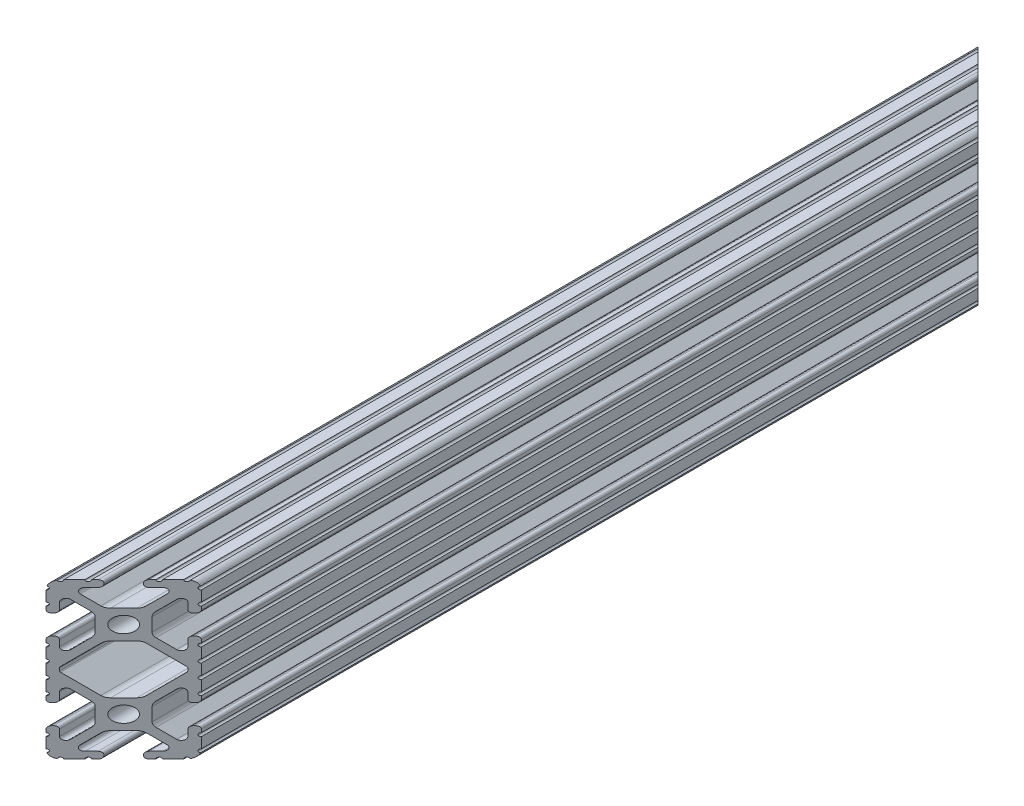
from build123d import *

# Parameters (mm, degrees)
BOSS_EXTRUDE1_DEPTH     = 152.4
CUT_EXTRUDE1_DEPTH      = 156.02325632
CUT_EXTRUDE1_DEPTH_BACK = 156.02325632
SKETCH5_R               = 0.55245
BOSS_EXTRUDE2_DEPTH     = 152.4
CUT_EXTRUDE2_DEPTH      = 156.02325632
CUT_EXTRUDE2_DEPTH_BACK = 156.02325632
CUT_EXTRUDE4_DEPTH      = 162.144934764


with BuildPart() as part:
    # Sketch4 → Boss-Extrude1 (new, symmetric)
    with BuildSketch(Plane.XY):
        with BuildLine():
            Line((4.190365, -25.4), (10.11729625, -25.4))
            ThreePointArc((10.11729625, -25.4), (11.943543585, -24.643543585), (12.7, -22.81729625))
            Line((12.7, -22.81729625), (12.7, -16.890365))
            ThreePointArc((12.7, -16.890365), (12.42492494, -16.22627506), (11.760835, -15.9512))
            Line((11.760835, -15.9512), (11.429365, -15.9512))
            ThreePointArc((11.429365, -15.9512), (10.76527506, -16.22627506), (10.4902, -16.890365))
            Line((10.4902, -16.890365), (10.4902, -19.048478019))
            ThreePointArc((10.4902, -19.048478019), (9.830707141, -20.035478831), (8.666460301, -19.803895736))
            Line((8.666460301, -19.803895736), (5.299899128, -16.437334563))
            ThreePointArc((5.299899128, -16.437334563), (4.817571085, -15.715479634), (4.6482, -14.86399369))
            Line((4.6482, -14.86399369), (4.6482, -12.7))
            Line((4.6482, -12.7), (2.6035, -12.7))
            ThreePointArc((2.6035, -12.7), (1.840952505, -14.540952505), (0, -15.3035))
            Line((0, -15.3035), (0, -17.3482))
            Line((0, -17.3482), (2.16399369, -17.3482))
            ThreePointArc((2.16399369, -17.3482), (3.015479634, -17.517571085), (3.737334563, -17.999899128))
            Line((3.737334563, -17.999899128), (7.103895736, -21.366460301))
            ThreePointArc((7.103895736, -21.366460301), (7.335478831, -22.530707141), (6.348478019, -23.1902))
            Line((6.348478019, -23.1902), (4.190365, -23.1902))
            ThreePointArc((4.190365, -23.1902), (3.52627506, -23.46527506), (3.2512, -24.129365))
            Line((3.2512, -24.129365), (3.2512, -24.460835))
            ThreePointArc((3.2512, -24.460835), (3.52627506, -25.12492494), (4.190365, -25.4))
        make_face()
    extrude(amount=BOSS_EXTRUDE1_DEPTH, both=True)

    # Sketch5 → Cut-Extrude1 (cut, two sides: drawn at the far end of the back side and taken through both)
    with BuildSketch(Plane.XY.offset(-CUT_EXTRUDE1_DEPTH_BACK)):
        with Locations((10.356153152, -25.4)):
            Circle(SKETCH5_R)
        with Locations((5.796028019, -25.4)):
            Circle(SKETCH5_R)
        with Locations((12.7, -23.056153152)):
            Circle(SKETCH5_R)
        with Locations((12.7, -18.496028019)):
            Circle(SKETCH5_R)
    extrude(amount=CUT_EXTRUDE1_DEPTH + CUT_EXTRUDE1_DEPTH_BACK, mode=Mode.SUBTRACT)

    # Mirror1: part across plane


with BuildPart() as part_1:
    add(part.part)
    add(part.part.mirror(Plane(origin=(4.6482, -12.7, 152.4), x_dir=(0, 0, 1), z_dir=(0, -1, 0))))

    # Sketch6 → Boss-Extrude2 (add, symmetric)
    with BuildSketch(Plane.XY):
        with BuildLine():
            Line((12.7, -1.791396848), (12.7, 0))
            Line((12.7, 0), (9.803703152, 0))
            Line((9.803703152, 0), (9.803703152, -2.343846848))
            Line((9.803703152, -2.343846848), (12.14755, -2.343846848))
            ThreePointArc((12.14755, -2.343846848), (12.309358859, -1.953205706), (12.7, -1.791396848))
        make_face()
    extrude(amount=BOSS_EXTRUDE2_DEPTH, both=True)

    # Sketch7 → Cut-Extrude2 (cut, two sides: drawn at the far end of the back side and taken through both)
    with BuildSketch(Plane.XY.offset(-CUT_EXTRUDE2_DEPTH_BACK)):
        with BuildLine():
            Line((5.420615149, -5.716820286), (10.328391141, -0.809044294))
            ThreePointArc((10.328391141, -0.809044294), (10.448147248, -0.629816615), (10.4902, -0.418403152))
            Line((10.4902, -0.418403152), (10.4902, 0))
            Line((10.4902, 0), (0, 0))
            Line((0, 0), (5.420615149, -5.716820286))
        make_face()
    extrude(amount=CUT_EXTRUDE2_DEPTH + CUT_EXTRUDE2_DEPTH_BACK, mode=Mode.SUBTRACT)

    # Mirror2: part across plane


with BuildPart() as part_2:
    add(part_1.part)
    add(part_1.part.mirror(Plane.ZX))

    # Mirror3: part across plane


with BuildPart() as part_3:
    add(part_2.part)
    add(part_2.part.mirror(Plane(origin=(0, 0, 0), x_dir=(0, 0, 1), z_dir=(1, 0, 0))))

    # Sketch9 → Cut-Extrude4 (cut, through all)
    with BuildSketch(Plane.XZ.offset(25.4)):
        Polygon((-12.7, 152.4), (12.7, 127), (12.7, 152.4), align=None)
        Polygon((12.7, -152.4), (-12.7, -152.4), (12.7, -127), align=None)
    extrude(amount=-CUT_EXTRUDE4_DEPTH, mode=Mode.SUBTRACT)


solid = part_3.part
